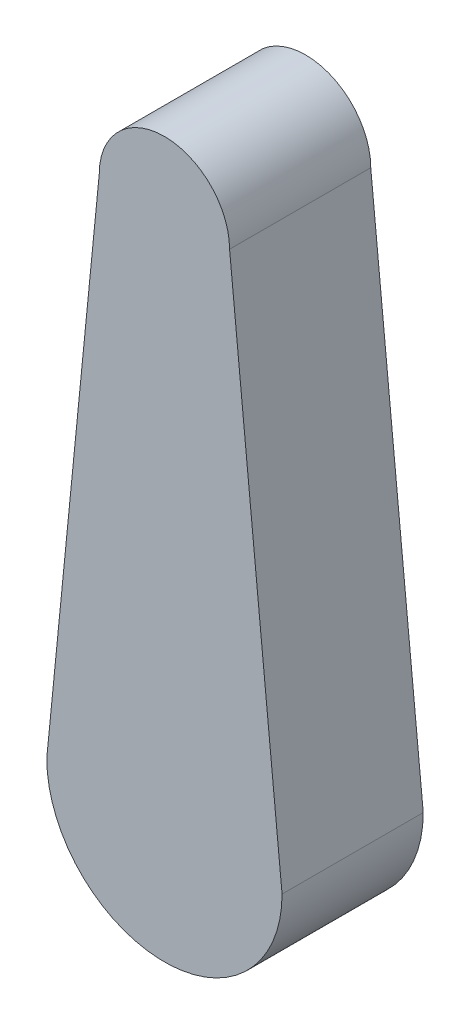
from build123d import *

# Parameters (mm, degrees)
DODANIE_WYCI_GNI_CIE1_DEPTH = 7.8


with BuildPart() as part:
    # Szkic1 → Dodanie-wyciągnięcie1 (new body)
    with BuildSketch(Plane.XY):
        with BuildLine():
            Line((-194.081077779, 106.324846477), (-196.981077779, 76.924846477))
            ThreePointArc((-196.981077779, 76.924846477), (-190.481077779, 70.424846477), (-183.981077779, 76.924846477))
            Line((-183.981077779, 76.924846477), (-186.881077779, 106.324846477))
            ThreePointArc((-186.881077779, 106.324846477), (-190.481077779, 109.924846477), (-194.081077779, 106.324846477))
        make_face()
    extrude(amount=-DODANIE_WYCI_GNI_CIE1_DEPTH)


solid = part.part
